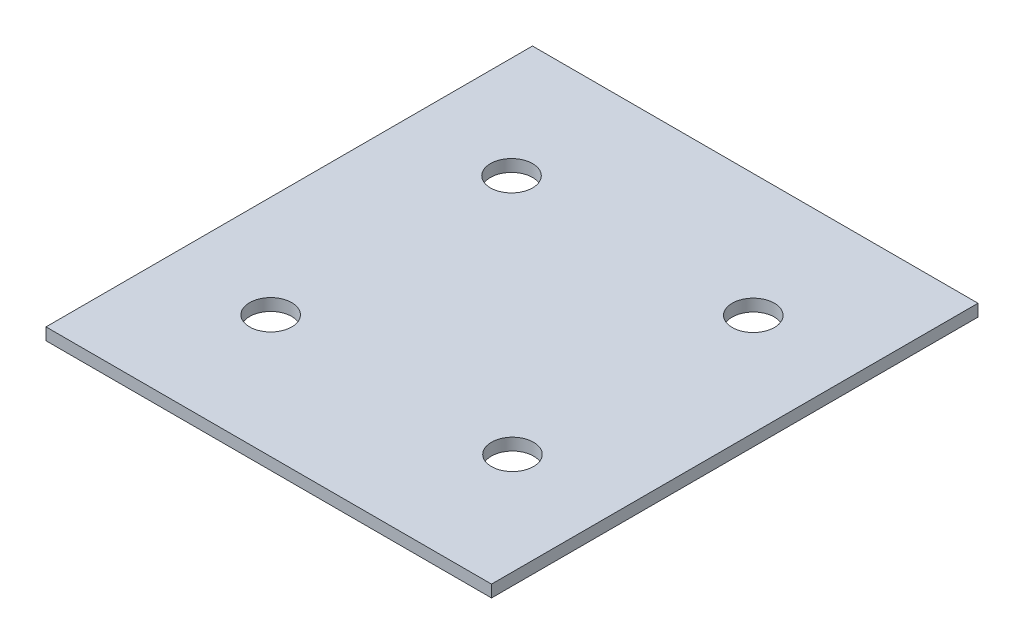
from build123d import *

# Parameters (mm, degrees)
SKETCH1_W           = 234.95
SKETCH1_H           = 6.35
BOSS_EXTRUDE1_DEPTH = 256.54
CUT_EXTRUDE1_REACH  = 284.229
SKETCH2_R           = 11.1125


with BuildPart() as part:
    # Sketch1 → Boss-Extrude1 (new body)
    with BuildSketch(Plane.XY):
        Rectangle(SKETCH1_W, SKETCH1_H)
    extrude(amount=BOSS_EXTRUDE1_DEPTH)

    # Sketch2 → Cut-Extrude1 (cut, up to next)
    with BuildSketch(Plane.XZ.offset(3.175), mode=Mode.PRIVATE) as cut_extrude1_sk1:
        with Locations((-63.754, 191.77)):
            Circle(SKETCH2_R)
    cut_extrude1_tool1 = extrude(cut_extrude1_sk1.sketch, amount=-CUT_EXTRUDE1_REACH, mode=Mode.PRIVATE) & part.part
    # Sketch2 → Cut-Extrude1 (cut, up to next)
    with BuildSketch(Plane.XZ.offset(3.175), mode=Mode.PRIVATE) as cut_extrude1_sk2:
        with Locations((-63.754, 64.77)):
            Circle(SKETCH2_R)
    cut_extrude1_tool2 = extrude(cut_extrude1_sk2.sketch, amount=-CUT_EXTRUDE1_REACH, mode=Mode.PRIVATE) & part.part
    # Sketch2 → Cut-Extrude1 (cut, up to next)
    with BuildSketch(Plane.XZ.offset(3.175), mode=Mode.PRIVATE) as cut_extrude1_sk3:
        with Locations((63.754, 64.77)):
            Circle(SKETCH2_R)
    cut_extrude1_tool3 = extrude(cut_extrude1_sk3.sketch, amount=-CUT_EXTRUDE1_REACH, mode=Mode.PRIVATE) & part.part
    # Sketch2 → Cut-Extrude1 (cut, up to next)
    with BuildSketch(Plane.XZ.offset(3.175), mode=Mode.PRIVATE) as cut_extrude1_sk4:
        with Locations((63.754, 191.77)):
            Circle(SKETCH2_R)
    cut_extrude1_tool4 = extrude(cut_extrude1_sk4.sketch, amount=-CUT_EXTRUDE1_REACH, mode=Mode.PRIVATE) & part.part
    add(cut_extrude1_tool1.solids().sort_by_distance((-63.754, -3.175, 191.77))[0], mode=Mode.SUBTRACT)
    add(cut_extrude1_tool2.solids().sort_by_distance((-63.754, -3.175, 64.77))[0], mode=Mode.SUBTRACT)
    add(cut_extrude1_tool3.solids().sort_by_distance((63.754, -3.175, 64.77))[0], mode=Mode.SUBTRACT)
    add(cut_extrude1_tool4.solids().sort_by_distance((63.754, -3.175, 191.77))[0], mode=Mode.SUBTRACT)


solid = part.part
